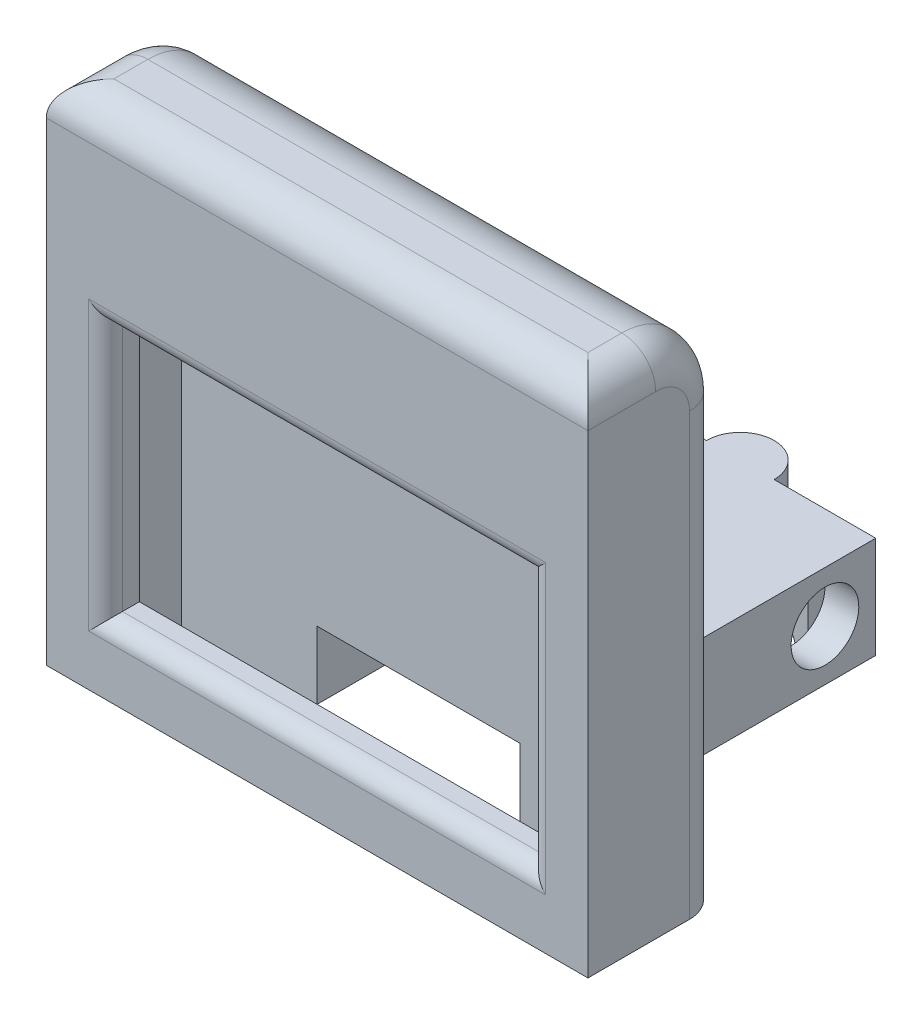
from build123d import *

# Parameters (mm, degrees)
ESQUISSE1_W              = 28
ESQUISSE1_H              = 28
BOSS_EXTRU_1_DEPTH       = 4
COQUE1_T                 = 2
ENL_V_MAT_EXTRU_1_REACH  = 45.174
ESQUISSE2_W              = 25
ESQUISSE2_H              = 15
ESQUISSE8_W              = 16
ESQUISSE8_H              = 6
BOSS_EXTRU_3_DEPTH       = 17
ESQUISSE10_W             = 12
ESQUISSE10_H             = 19.153338928
ENL_V_MAT_EXTRU_3_DEPTH  = 4
ESQUISSE11_R             = 2
ENL_V_MAT_EXTRU_4_DEPTH  = 2
ENL_V_START              = -2
ESQUISSE13_R             = 2
ENL_V_MAT_EXTRU_9_DEPTH  = 2
ESQUISSE15_R             = 2
BOSS_EXTRU_5_DEPTH       = 6
ESQUISSE16_R             = 2
BOSS_EXTRU_6_DEPTH       = 6
ESQUISSE17_R             = 2
BOSS_EXTRU_7_DEPTH       = 6
ESQUISSE18_R             = 1
ENL_V_MAT_EXTRU_10_DEPTH = 5.5
CONG_1_R                 = 4
CONG_2_R                 = 2
CONG_3_R                 = 1
ENL_V_MAT_EXTRU_11_REACH = 51.244
ESQUISSE19_R             = 1.25
ENL_V_MAT_EXTRU_12_DEPTH = 1.5


with BuildPart() as part:
    # Esquisse1 → Boss.-Extru.1 (new body)
    with BuildSketch(Plane.XY):
        with Locations((14, 14)):
            Rectangle(ESQUISSE1_W, ESQUISSE1_H)
    extrude(amount=BOSS_EXTRU_1_DEPTH)

    # Coque1
    coque1_openings = [part.faces().sort_by_distance(p)[0] for p in [
        (14, 0, 2),
    ]]
    offset(amount=COQUE1_T, openings=coque1_openings, kind=Kind.INTERSECTION)

    # Esquisse2 → Enlèv. mat.-Extru.1 (cut, up to next)
    with BuildSketch(Plane.XY.offset(6), mode=Mode.PRIVATE) as enl_v_mat_extru_1_sk1:
        with Locations((14, 11.5)):
            Rectangle(ESQUISSE2_W, ESQUISSE2_H)
    enl_v_mat_extru_1_tool1 = extrude(enl_v_mat_extru_1_sk1.sketch, amount=-ENL_V_MAT_EXTRU_1_REACH, mode=Mode.PRIVATE) & part.part
    add(enl_v_mat_extru_1_tool1.solids().sort_by_distance((14, 11.5, 6))[0], mode=Mode.SUBTRACT)

    # Esquisse8 → Boss.-Extru.3 (add)
    with BuildSketch(Plane(origin=(0, 0, -2), x_dir=(-1, 0, 0), z_dir=(0, 0, -1))):
        with Locations((-14, 3)):
            Rectangle(ESQUISSE8_W, ESQUISSE8_H)
    extrude(amount=BOSS_EXTRU_3_DEPTH)

    # Esquisse10 → Enlèv. mat.-Extru.3 (cut)
    with BuildSketch(Plane.XZ):
        with Locations((14, -7.423330536)):
            Rectangle(ESQUISSE10_W, ESQUISSE10_H)
    extrude(amount=-ENL_V_MAT_EXTRU_3_DEPTH, mode=Mode.SUBTRACT)

    # Esquisse11 → Enlèv. mat.-Extru.4 (cut)
    with BuildSketch(Plane(origin=(22, 0, 0), x_dir=(0, 0, -1), z_dir=(1, 0, 0))):
        with Locations(Location((16, 3, 0), (0, 0, 90))):
            Circle(ESQUISSE11_R)
    extrude(amount=-ENL_V_MAT_EXTRU_4_DEPTH, mode=Mode.SUBTRACT)

    # Esquisse13 → Enlèv. mat.-Extru.9 (cut)
    with BuildSketch(Plane.ZY.offset(-6).offset(ENL_V_START)):
        with Locations(Location((-16, 3, 0), (0, 0, 90))):
            Circle(ESQUISSE13_R)
    extrude(amount=ENL_V_MAT_EXTRU_9_DEPTH, mode=Mode.SUBTRACT)

    # Esquisse15 → Boss.-Extru.5 (add)
    with BuildSketch(Plane.XZ):
        with Locations((6, -2)):
            Circle(ESQUISSE15_R)
    extrude(amount=-BOSS_EXTRU_5_DEPTH)

    # Esquisse16 → Boss.-Extru.6 (add)
    with BuildSketch(Plane.XZ):
        with Locations((22, -2)):
            Circle(ESQUISSE16_R)
    extrude(amount=-BOSS_EXTRU_6_DEPTH)

    # Esquisse17 → Boss.-Extru.7 (add)
    with BuildSketch(Plane.XZ):
        with Locations((14, -19)):
            Circle(ESQUISSE17_R)
    extrude(amount=-BOSS_EXTRU_7_DEPTH)

    # Esquisse18 → Enlèv. mat.-Extru.10 (cut)
    with BuildSketch(Plane.XZ):
        with Locations(Location((6, -2, 0), (0, 0, 270))):
            Circle(ESQUISSE18_R)
        with Locations(Location((14, -19, 0), (0, 0, 270))):
            Circle(ESQUISSE18_R)
        with Locations(Location((22, -2, 0), (0, 0, 270))):
            Circle(ESQUISSE18_R)
    extrude(amount=-ENL_V_MAT_EXTRU_10_DEPTH, mode=Mode.SUBTRACT)

    # Congé1
    cong_1_edges = [part.edges().sort_by_distance(p)[0] for p in [
        (14, 30, -2),
    ]]
    fillet(cong_1_edges, radius=CONG_1_R)

    # Congé2
    cong_2_edges = [part.edges().sort_by_distance(p)[0] for p in [
        (14, 30, 6),
        (-2, 13, -2),
        (-2, 28.828427125, -0.828427125),
        (30, 28.828427125, -0.828427125),
        (30, 13, -2),
        (-2, 30, 4),
        (30, 30, 4),
    ]]
    fillet(cong_2_edges, radius=CONG_2_R)

    # Congé3
    cong_3_edges = [part.edges().sort_by_distance(p)[0] for p in [
        (1.5, 11.5, 6),
        (14, 4, 6),
        (26.5, 11.5, 6),
        (14, 19, 6),
    ]]
    fillet(cong_3_edges, radius=CONG_3_R)

    # Esquisse19 → Enlèv. mat.-Extru.11 (cut, up to next)
    with BuildSketch(Plane(origin=(0, 0, -19), x_dir=(-1, 0, 0), z_dir=(0, 0, -1)), mode=Mode.PRIVATE) as enl_v_mat_extru_11_sk1:
        with Locations((-18, 0)):
            Circle(ESQUISSE19_R)
    enl_v_mat_extru_11_tool1 = extrude(enl_v_mat_extru_11_sk1.sketch, amount=-ENL_V_MAT_EXTRU_11_REACH, mode=Mode.PRIVATE) & part.part
    add(enl_v_mat_extru_11_tool1.solids().sort_by_distance((18, 0, -19))[0], mode=Mode.SUBTRACT)

    # Esquisse20 → Enlèv. mat.-Extru.12 (cut)
    # profile 1 of 11: a face of its own
    with BuildSketch(Plane(origin=(0, 0, -2), x_dir=(-1, 0, 0), z_dir=(0, 0, -1))):
        Polygon((-26.991777923, 22.198020815), (-26.677675359, 22.198020815), (-26.677675359, 20.762123379), (-24.882803564, 20.762123379), (-24.882803564, 22.198020815), (-24.568701, 22.198020815), (-24.568701, 18.698020815), (-24.882803564, 18.698020815), (-24.882803564, 20.40314902), (-26.677675359, 20.40314902), (-26.677675359, 18.698020815), (-26.991777923, 18.698020815), align=None)
    # profile 2 of 11: a face of its own
    with BuildSketch(Plane(origin=(0, 0, -2), x_dir=(-1, 0, 0), z_dir=(0, 0, -1))):
        with BuildLine():
            Line((-23.671265103, 22.198020815), (-23.357162539, 22.198020815))
            Line((-23.357162539, 22.198020815), (-23.357162539, 20.100965527))
            add(Edge.make_bspline(
                [(-23.357162539, 20.100965527), (-23.357209283, 20.071284791), (-23.357297987, 20.01496048), (-23.356705474, 19.93479218), (-23.355046105, 19.863519721), (-23.353999946, 19.800868373), (-23.351672612, 19.747125626), (-23.349774565, 19.702000315), (-23.347334009, 19.665706112), (-23.344400891, 19.644525186), (-23.343140103, 19.635420655)],
                knots=[0, 0, 0, 0, 1.528628734, 2.90083645, 4.128790002, 5.200304208, 6.127813768, 6.898992206, 7.526736466, 8, 8, 8, 8], degree=3))
            add(Edge.make_bspline(
                [(-23.343140103, 19.635420655), (-23.337962644, 19.602573892), (-23.327899458, 19.538731163), (-23.30225308, 19.447822881), (-23.266435579, 19.365891422), (-23.223992536, 19.290380131), (-23.168059925, 19.223390771), (-23.10105639, 19.161679118), (-23.019878621, 19.107707314), (-22.929618015, 19.058356502), (-22.832332778, 19.01869142), (-22.732921512, 18.988698055), (-22.632878532, 18.970419156), (-22.565902367, 18.968302617), (-22.532643308, 18.967251585)],
                knots=[0, 0, 0, 0, 1.035780045, 2.013197591, 2.933192213, 3.817615948, 4.702609284, 5.640816605, 6.646850145, 7.73207398, 8.84249596, 9.914020372, 10.964143139, 12, 12, 12, 12], degree=3))
            add(Edge.make_bspline(
                [(-22.532643308, 18.967251585), (-22.504089568, 18.968325435), (-22.447147006, 18.970466933), (-22.362540575, 18.983728364), (-22.280140466, 19.00762893), (-22.199539786, 19.038468688), (-22.123988802, 19.079216279), (-22.05344536, 19.126287119), (-21.990481426, 19.181497995), (-21.933023428, 19.242598339), (-21.882988492, 19.311538139), (-21.839617351, 19.386816277), (-21.804091421, 19.469565624), (-21.786547896, 19.527720046), (-21.777535135, 19.557596136)],
                knots=[0, 0, 0, 0, 0.994687771, 1.983630487, 2.973142513, 3.978332533, 4.983357753, 5.956394766, 6.925816176, 7.893390482, 8.871859704, 9.88551698, 10.913711441, 12, 12, 12, 12], degree=3))
            add(Edge.make_bspline(
                [(-21.777535135, 19.557596136), (-21.77453501, 19.56994471), (-21.767849521, 19.59746231), (-21.761602476, 19.643983601), (-21.755095951, 19.698872965), (-21.750581381, 19.762524778), (-21.746180161, 19.83472575), (-21.743547088, 19.915852008), (-21.742330055, 20.005608968), (-21.741967375, 20.06824613), (-21.741777923, 20.100965527)],
                knots=[0, 0, 0, 0, 0.558680831, 1.244966039, 2.062412453, 2.990489873, 4.051219941, 5.244515665, 6.560634259, 8, 8, 8, 8], degree=3))
            Line((-21.741777923, 20.100965527), (-21.741777923, 22.198020815))
            Line((-21.741777923, 22.198020815), (-21.427675359, 22.198020815))
            Line((-21.427675359, 22.198020815), (-21.427675359, 20.084138604))
            add(Edge.make_bspline(
                [(-21.427675359, 20.084138604), (-21.42792948, 20.046040225), (-21.428425411, 19.971688922), (-21.432725988, 19.862737563), (-21.439582987, 19.759384582), (-21.449271075, 19.661616085), (-21.462108079, 19.569781926), (-21.476383299, 19.483077158), (-21.494562832, 19.402124165), (-21.515796233, 19.326291747), (-21.540069781, 19.254106234), (-21.57151093, 19.185597619), (-21.60693543, 19.11868322), (-21.648950083, 19.054375111), (-21.696161465, 18.992388558), (-21.749613146, 18.933099483), (-21.807537307, 18.875560436), (-21.870896866, 18.82124737), (-21.938647392, 18.771438693), (-22.010587349, 18.727640922), (-22.086164119, 18.690617305), (-22.165181245, 18.66014138), (-22.247672448, 18.637226781), (-22.333639808, 18.620151625), (-22.423279001, 18.610449328), (-22.484243657, 18.609007398), (-22.515115263, 18.608277226)],
                knots=[0, 0, 0, 0, 1.316592851, 2.569410997, 3.76748051, 4.895814652, 5.963796859, 6.97159953, 7.931736103, 8.829262218, 9.692595152, 10.560224239, 11.431080259, 12.30701507, 13.211635791, 14.121146779, 15.063487852, 16.031507147, 17.00238618, 17.966455255, 18.938106653, 19.907068911, 20.888905087, 21.893141452, 22.933117798, 24, 24, 24, 24], degree=3))
            add(Edge.make_bspline(
                [(-22.515115263, 18.608277226), (-22.548784366, 18.609061991), (-22.614843025, 18.610601697), (-22.712181092, 18.619424448), (-22.805495288, 18.636042842), (-22.895771165, 18.657202786), (-22.981779662, 18.686386523), (-23.064673107, 18.720484648), (-23.143031788, 18.762361908), (-23.218126916, 18.808955301), (-23.287951673, 18.861379939), (-23.352049076, 18.918520113), (-23.410524946, 18.979460491), (-23.462393643, 19.044860856), (-23.508514527, 19.114212563), (-23.548244741, 19.187711803), (-23.582357985, 19.265330119), (-23.599964552, 19.31928332), (-23.608865263, 19.346558476)],
                knots=[0, 0, 0, 0, 1.13879206, 2.234305948, 3.301075583, 4.341971843, 5.366689343, 6.369221514, 7.369726634, 8.367512178, 9.355451585, 10.318319045, 11.268648973, 12.207971039, 13.137398894, 14.081662264, 15.030215811, 16, 16, 16, 16], degree=3))
            add(Edge.make_bspline(
                [(-23.608865263, 19.346558476), (-23.614042421, 19.36519105), (-23.625271793, 19.405605519), (-23.63729709, 19.472492007), (-23.647406172, 19.549506925), (-23.65691173, 19.636655544), (-23.662520688, 19.73400541), (-23.667438127, 19.841514326), (-23.671299746, 19.959312288), (-23.671276973, 20.041366803), (-23.671265103, 20.084138604)],
                knots=[0, 0, 0, 0, 0.625038921, 1.35572334, 2.194682327, 3.136881307, 4.189498639, 5.346923369, 6.617055217, 8, 8, 8, 8], degree=3))
            Line((-23.671265103, 20.084138604), (-23.671265103, 22.198020815))
        make_face()
    # profile 3 of 11: a face of its own
    with BuildSketch(Plane(origin=(0, 0, -2), x_dir=(-1, 0, 0), z_dir=(0, 0, -1))):
        Polygon((-20.709726641, 18.698020815), (-20.247687379, 22.198020815), (-20.202815584, 22.198020815), (-18.757803564, 19.326225943), (-17.316297154, 22.198020815), (-17.270724237, 22.198020815), (-16.805880487, 18.698020815), (-17.121385295, 18.698020815), (-17.456521513, 21.216450302), (-18.719942987, 18.698020815), (-18.790756289, 18.698020815), (-20.059085616, 21.222059277), (-20.393520712, 18.698020815), align=None)
    # profile 4 of 11: a face of its own
    with BuildSketch(Plane(origin=(0, 0, -2), x_dir=(-1, 0, 0), z_dir=(0, 0, -1))):
        Polygon((-14.652034334, 22.198020815), (-13.036649718, 18.698020815), (-13.378096032, 18.698020815), (-13.895523917, 19.819815687), (-15.482162539, 19.819815687), (-16.014313981, 18.698020815), (-16.357162539, 18.698020815), (-14.696906129, 22.198020815), align=None)
        Polygon((-14.67797584, 21.515829309), (-15.311789943, 20.178790046), (-14.060988661, 20.178790046), align=None, mode=Mode.SUBTRACT)
    # profile 5 of 11: a face of its own
    with BuildSketch(Plane(origin=(0, 0, -2), x_dir=(-1, 0, 0), z_dir=(0, 0, -1))):
        Polygon((-12.40844459, 18.698020815), (-12.40844459, 22.198020815), (-12.342539141, 22.198020815), (-10.030239462, 19.443313283), (-10.030239462, 22.198020815), (-9.716136898, 22.198020815), (-9.716136898, 18.698020815), (-9.787651321, 18.698020815), (-12.094342026, 21.446418251), (-12.094342026, 18.698020815), align=None)
    # profile 6 of 11: a face of its own
    with BuildSketch(Plane(origin=(0, 0, -2), x_dir=(-1, 0, 0), z_dir=(0, 0, -1))):
        Polygon((-8.818701, 22.198020815), (-8.504598436, 22.198020815), (-8.504598436, 19.056995174), (-7.15844459, 19.056995174), (-7.15844459, 18.698020815), (-8.818701, 18.698020815), align=None)
    # profile 7 of 11: a face of its own
    with BuildSketch(Plane(origin=(0, 0, -2), x_dir=(-1, 0, 0), z_dir=(0, 0, -1))):
        Polygon((-5.139213821, 22.198020815), (-3.523829205, 18.698020815), (-3.86527552, 18.698020815), (-4.382703404, 19.819815687), (-5.969342026, 19.819815687), (-6.501493468, 18.698020815), (-6.844342026, 18.698020815), (-5.184085616, 22.198020815), align=None)
        Polygon((-5.165155327, 21.515829309), (-5.79896943, 20.178790046), (-4.548168148, 20.178790046), align=None, mode=Mode.SUBTRACT)
    # profile 8 of 11: a face of its own
    with BuildSketch(Plane(origin=(0, 0, -2), x_dir=(-1, 0, 0), z_dir=(0, 0, -1))):
        with BuildLine():
            Line((-2.895624077, 22.198020815), (-2.212731449, 22.198020815))
            add(Edge.make_bspline(
                [(-2.212731449, 22.198020815), (-2.179302971, 22.197845065), (-2.114510261, 22.197504417), (-2.020290819, 22.192221286), (-1.932042008, 22.185017616), (-1.849738236, 22.173587523), (-1.773417533, 22.159795746), (-1.702849896, 22.14309393), (-1.638259724, 22.123067316), (-1.561146987, 22.091221035), (-1.473226327, 22.043897867), (-1.378027934, 21.973969302), (-1.296623694, 21.888436838), (-1.226437377, 21.791954183), (-1.170636258, 21.685818411), (-1.13026696, 21.572559223), (-1.104709085, 21.453637481), (-1.102080651, 21.371994303), (-1.100752282, 21.330733155)],
                knots=[0, 0, 0, 0, 1.001505555, 1.941167018, 2.826882275, 3.653841531, 4.429895133, 5.150066043, 5.825578002, 6.45369114, 7.647487171, 8.808567382, 9.977351308, 11.170798116, 12.373658725, 13.556498008, 14.765093433, 16, 16, 16, 16], degree=3))
            add(Edge.make_bspline(
                [(-1.100752282, 21.330733155), (-1.101845501, 21.292080599), (-1.103993778, 21.216124682), (-1.124536537, 21.105030573), (-1.156697206, 20.999279354), (-1.201402455, 20.899256969), (-1.259504451, 20.807223356), (-1.32836277, 20.72243609), (-1.411439572, 20.648485033), (-1.473682812, 20.60714213), (-1.505299558, 20.586141809)],
                knots=[0, 0, 0, 0, 1.044552857, 2.05264487, 3.044412934, 4.028983338, 5.005914585, 5.980388656, 6.974128949, 8, 8, 8, 8], degree=3))
            add(Edge.make_bspline(
                [(-1.505299558, 20.586141809), (-1.46553913, 20.57087681), (-1.389467583, 20.541671086), (-1.284781571, 20.490035622), (-1.194586726, 20.433873511), (-1.11818958, 20.372541661), (-1.052851925, 20.30643285), (-0.995798983, 20.234577736), (-0.947117609, 20.156038978), (-0.905404685, 20.071635443), (-0.872855929, 19.982228974), (-0.848480025, 19.888658198), (-0.834512576, 19.791258643), (-0.832524935, 19.724973264), (-0.831521513, 19.691510399)],
                knots=[0, 0, 0, 0, 1.27268992, 2.434971085, 3.483601985, 4.442670788, 5.356604649, 6.2567628, 7.179492994, 8.113709626, 9.066344395, 10.018646069, 10.999752585, 12, 12, 12, 12], degree=3))
            add(Edge.make_bspline(
                [(-0.831521513, 19.691510399), (-0.832498359, 19.657343527), (-0.834420331, 19.590119248), (-0.848600303, 19.491364114), (-0.87260941, 19.396989167), (-0.905680556, 19.306383985), (-0.948842871, 19.21972385), (-1.001370835, 19.136910586), (-1.064002399, 19.058776255), (-1.134065268, 18.984452632), (-1.213327413, 18.917624845), (-1.298843168, 18.858109138), (-1.391689488, 18.809163076), (-1.490341482, 18.768047055), (-1.595905798, 18.736639856), (-1.707908406, 18.714667282), (-1.826252707, 18.699862245), (-1.907462458, 18.69864504), (-1.949109654, 18.698020815)],
                knots=[0, 0, 0, 0, 0.978564426, 1.925352924, 2.850884081, 3.763762016, 4.682927383, 5.618979971, 6.567305752, 7.547517671, 8.540179244, 9.531824382, 10.526200242, 11.540722885, 12.589160233, 13.674978461, 14.80764778, 16, 16, 16, 16], degree=3))
            Line((-1.949109654, 18.698020815), (-2.895624077, 18.698020815))
            Line((-2.895624077, 18.698020815), (-2.895624077, 22.198020815))
        make_face()
        with BuildLine():
            Line((-2.581521513, 21.839046456), (-2.581521513, 20.717251585))
            Line((-2.581521513, 20.717251585), (-2.370483853, 20.717251585))
            add(Edge.make_bspline(
                [(-2.370483853, 20.717251585), (-2.339635058, 20.717651508), (-2.280028898, 20.71842424), (-2.193709002, 20.720637757), (-2.113583984, 20.726835801), (-2.03979215, 20.733032063), (-1.972449706, 20.74310665), (-1.911705845, 20.755098773), (-1.856607248, 20.767781678), (-1.793067702, 20.789351165), (-1.720994754, 20.821228841), (-1.64416165, 20.870700677), (-1.57642718, 20.92962503), (-1.519229993, 20.997615992), (-1.472418522, 21.072482177), (-1.439904807, 21.153029058), (-1.417857523, 21.23724919), (-1.415865991, 21.295067443), (-1.414854846, 21.324423059)],
                knots=[0, 0, 0, 0, 1.156816544, 2.235205308, 3.236616184, 4.169592532, 5.011045266, 5.787822928, 6.49130361, 7.128639758, 8.301311294, 9.436451833, 10.541879658, 11.654887649, 12.756523258, 13.837046038, 14.901820046, 16, 16, 16, 16], degree=3))
            add(Edge.make_bspline(
                [(-1.414854846, 21.324423059), (-1.415381027, 21.34384883), (-1.416413187, 21.381954602), (-1.424866489, 21.437503957), (-1.439234064, 21.489747709), (-1.457688357, 21.539401819), (-1.483477046, 21.58491367), (-1.513840509, 21.627856865), (-1.550526199, 21.666768984), (-1.592283512, 21.703138482), (-1.640292135, 21.73538301), (-1.694523426, 21.763623773), (-1.755711104, 21.78636455), (-1.822823959, 21.806280702), (-1.896895046, 21.820268996), (-1.977069599, 21.831922384), (-2.064004318, 21.837855126), (-2.124149421, 21.838640489), (-2.155239462, 21.839046456)],
                knots=[0, 0, 0, 0, 0.91205012, 1.789085906, 2.630437955, 3.453916878, 4.269457761, 5.079663411, 5.91843418, 6.774407191, 7.675494373, 8.627863946, 9.638891023, 10.736472738, 11.911756761, 13.175263542, 14.539845004, 16, 16, 16, 16], degree=3))
            Line((-2.155239462, 21.839046456), (-2.581521513, 21.839046456))
        make_face(mode=Mode.SUBTRACT)
        with BuildLine():
            Line((-2.581521513, 20.358277226), (-2.581521513, 19.056995174))
            Line((-2.581521513, 19.056995174), (-2.134205808, 19.056995174))
            add(Edge.make_bspline(
                [(-2.134205808, 19.056995174), (-2.102186882, 19.057378922), (-2.040474624, 19.058118544), (-1.951373393, 19.060533099), (-1.86879029, 19.066025374), (-1.793102154, 19.074671224), (-1.723491701, 19.084049673), (-1.660793998, 19.096660954), (-1.604500805, 19.111109915), (-1.539226497, 19.133444087), (-1.465722989, 19.168140558), (-1.386512132, 19.220454784), (-1.316085914, 19.282778092), (-1.256280655, 19.354909006), (-1.207267666, 19.433340333), (-1.171612211, 19.516485683), (-1.149621355, 19.602971211), (-1.146959185, 19.661937923), (-1.145624077, 19.691510399)],
                knots=[0, 0, 0, 0, 1.160039823, 2.235823828, 3.228722157, 4.157150951, 4.99529583, 5.772374946, 6.472645482, 7.099169577, 8.269452708, 9.405989375, 10.527446681, 11.663510218, 12.788923519, 13.866172445, 14.929861265, 16, 16, 16, 16], degree=3))
            add(Edge.make_bspline(
                [(-1.145624077, 19.691510399), (-1.145900182, 19.710003739), (-1.146447937, 19.746692121), (-1.154708552, 19.80060794), (-1.166722421, 19.852833813), (-1.182253855, 19.903511554), (-1.204873322, 19.95172493), (-1.231279867, 19.99842749), (-1.262241269, 20.043680969), (-1.310485435, 20.100893223), (-1.380657419, 20.166810236), (-1.480364195, 20.231347738), (-1.593736493, 20.283395545), (-1.675963986, 20.305495021), (-1.718440584, 20.31691104)],
                knots=[0, 0, 0, 0, 0.723448775, 1.435228256, 2.130040452, 2.821711965, 3.505591119, 4.210454504, 4.921174351, 5.648778258, 7.137944449, 8.670945889, 10.280296675, 12, 12, 12, 12], degree=3))
            add(Edge.make_bspline(
                [(-1.718440584, 20.31691104), (-1.735469679, 20.320366124), (-1.772392272, 20.327857458), (-1.832599852, 20.335765162), (-1.901335721, 20.342810222), (-1.978758598, 20.348021379), (-2.06496644, 20.353407923), (-2.160143358, 20.355502744), (-2.263900673, 20.358002004), (-2.335893045, 20.358183138), (-2.37328834, 20.358277226)],
                knots=[0, 0, 0, 0, 0.634451884, 1.375622551, 2.216452059, 3.157844607, 4.20941857, 5.370758133, 6.634282058, 8, 8, 8, 8], degree=3))
            Line((-2.37328834, 20.358277226), (-2.581521513, 20.358277226))
        make_face(mode=Mode.SUBTRACT)
    # profile 9 of 11: a face of its own
    with BuildSketch(Plane(origin=(0, 0, -2), x_dir=(-1, 0, 0), z_dir=(0, 0, -1))):
        with BuildLine():
            Line((-18.291132891, 15.128746726), (-17.604734654, 15.128746726))
            add(Edge.make_bspline(
                [(-17.604734654, 15.128746726), (-17.557523747, 15.12869483), (-17.467065555, 15.128595395), (-17.337350499, 15.125580649), (-17.219540767, 15.121553957), (-17.113890386, 15.115972063), (-17.020074288, 15.109375473), (-16.938516989, 15.100123434), (-16.868577432, 15.090463138), (-16.826670983, 15.080641732), (-16.807559173, 15.076162592)],
                knots=[0, 0, 0, 0, 1.415646017, 2.712440637, 3.8905458, 4.950247383, 5.884950622, 6.709939814, 7.411656543, 8, 8, 8, 8], degree=3))
            add(Edge.make_bspline(
                [(-16.807559173, 15.076162592), (-16.783365639, 15.069540642), (-16.735548662, 15.05645278), (-16.666647619, 15.030239057), (-16.601093773, 14.999156891), (-16.538662215, 14.963732952), (-16.480120132, 14.922447387), (-16.424594091, 14.87697377), (-16.37257411, 14.826262201), (-16.324352719, 14.770881461), (-16.280067921, 14.711761251), (-16.241938238, 14.648019022), (-16.210011011, 14.580727718), (-16.18262774, 14.509934147), (-16.162919285, 14.435043823), (-16.148072386, 14.356577111), (-16.138648758, 14.274542421), (-16.137746196, 14.218482553), (-16.137286737, 14.189944643)],
                knots=[0, 0, 0, 0, 0.999701418, 1.975846123, 2.934577507, 3.890451536, 4.834027766, 5.787354733, 6.749476667, 7.726910423, 8.712836071, 9.690891519, 10.682875813, 11.679750201, 12.712814741, 13.765529915, 14.8625177, 16, 16, 16, 16], degree=3))
            add(Edge.make_bspline(
                [(-16.137286737, 14.189944643), (-16.137708162, 14.161166866), (-16.138532708, 14.104861202), (-16.148428993, 14.022488414), (-16.161759185, 13.943770024), (-16.182256237, 13.868880573), (-16.20910191, 13.798264803), (-16.240593963, 13.730843571), (-16.278577493, 13.667763899), (-16.322222323, 13.608796782), (-16.370773917, 13.553886869), (-16.424026855, 13.503432075), (-16.481766148, 13.457727736), (-16.543808296, 13.416671393), (-16.610758145, 13.381215113), (-16.681600298, 13.349457808), (-16.756950515, 13.322786748), (-16.809093029, 13.308756686), (-16.835604045, 13.301623329)],
                knots=[0, 0, 0, 0, 1.121902311, 2.195077645, 3.232258892, 4.234102512, 5.217864754, 6.176164875, 7.132989551, 8.084763148, 9.034132444, 9.988522005, 10.94243251, 11.903244335, 12.886203696, 13.894208494, 14.929344452, 16, 16, 16, 16], degree=3))
            add(Edge.make_bspline(
                [(-16.835604045, 13.301623329), (-16.857531379, 13.296960348), (-16.905586406, 13.286741154), (-16.984729128, 13.275332697), (-17.076874514, 13.265595096), (-17.181896794, 13.258293959), (-17.299701699, 13.25204359), (-17.430352956, 13.247075496), (-17.574107033, 13.244345642), (-17.674378277, 13.24420485), (-17.726729846, 13.244131342)],
                knots=[0, 0, 0, 0, 0.601384939, 1.31797006, 2.144135048, 3.087295005, 4.142315834, 5.309527816, 6.595305764, 8, 8, 8, 8], degree=3))
            Line((-17.726729846, 13.244131342), (-17.977030327, 13.244131342))
            Line((-17.977030327, 13.244131342), (-17.977030327, 11.628746726))
            Line((-17.977030327, 11.628746726), (-18.291132891, 11.628746726))
            Line((-18.291132891, 11.628746726), (-18.291132891, 15.128746726))
        make_face()
        with BuildLine():
            Line((-17.977030327, 14.769772367), (-17.977030327, 13.603105701))
            Line((-17.977030327, 13.603105701), (-17.364249878, 13.595393361))
            add(Edge.make_bspline(
                [(-17.364249878, 13.595393361), (-17.334329952, 13.595377897), (-17.276570152, 13.595348045), (-17.193133929, 13.599333269), (-17.115724642, 13.603933801), (-17.044580066, 13.610669725), (-16.979668132, 13.620190982), (-16.920880603, 13.62980272), (-16.86867332, 13.643708083), (-16.807574118, 13.662431152), (-16.739490771, 13.694363768), (-16.665423222, 13.740713658), (-16.602652636, 13.799794366), (-16.548334339, 13.866222197), (-16.505228461, 13.940121327), (-16.473672469, 14.019190263), (-16.455131312, 14.102618113), (-16.452645118, 14.159706252), (-16.451389301, 14.188542399)],
                knots=[0, 0, 0, 0, 1.160613943, 2.240541288, 3.23993089, 4.169200891, 5.011653406, 5.7853311, 6.478053781, 7.106038997, 8.262395093, 9.384106736, 10.481365981, 11.59014053, 12.70357646, 13.786202915, 14.881775077, 16, 16, 16, 16], degree=3))
            add(Edge.make_bspline(
                [(-16.451389301, 14.188542399), (-16.452651948, 14.216680913), (-16.455161932, 14.272616795), (-16.473817796, 14.354595556), (-16.50516711, 14.43283126), (-16.548623704, 14.505804345), (-16.601364834, 14.571993149), (-16.662664177, 14.629490276), (-16.732377438, 14.675711979), (-16.797225669, 14.705545261), (-16.854826855, 14.723760536), (-16.904858815, 14.736505377), (-16.96134949, 14.746680983), (-17.024317269, 14.754920486), (-17.093274103, 14.761973947), (-17.168812418, 14.766759924), (-17.250646061, 14.76956138), (-17.307456632, 14.769700336), (-17.336906128, 14.769772367)],
                knots=[0, 0, 0, 0, 1.120700087, 2.227813068, 3.331159281, 4.466773991, 5.599788987, 6.693661531, 7.80175334, 8.91857717, 9.525282508, 10.207424825, 10.974604443, 11.810962634, 12.737642355, 13.736264703, 14.826523623, 16, 16, 16, 16], degree=3))
            Line((-17.336906128, 14.769772367), (-17.977030327, 14.769772367))
        make_face(mode=Mode.SUBTRACT)
    # profile 10 of 11: a face of its own
    with BuildSketch(Plane(origin=(0, 0, -2), x_dir=(-1, 0, 0), z_dir=(0, 0, -1))):
        with BuildLine():
            Line((-15.419338019, 15.128746726), (-15.105235455, 15.128746726))
            Line((-15.105235455, 15.128746726), (-15.105235455, 13.031691438))
            add(Edge.make_bspline(
                [(-15.105235455, 13.031691438), (-15.105282199, 13.002010702), (-15.105370904, 12.945686391), (-15.10477839, 12.865518091), (-15.103119021, 12.794245632), (-15.102072862, 12.731594284), (-15.099745528, 12.677851537), (-15.097847481, 12.632726226), (-15.095406925, 12.596432023), (-15.092473807, 12.575251097), (-15.091213019, 12.566146566)],
                knots=[0, 0, 0, 0, 1.528628734, 2.90083645, 4.128790002, 5.200304208, 6.127813768, 6.898992206, 7.526736466, 8, 8, 8, 8], degree=3))
            add(Edge.make_bspline(
                [(-15.091213019, 12.566146566), (-15.08603556, 12.533299803), (-15.075972374, 12.469457074), (-15.050325996, 12.378548792), (-15.014508495, 12.296617333), (-14.972065452, 12.221106042), (-14.916132841, 12.154116682), (-14.849129306, 12.092405029), (-14.767951537, 12.038433225), (-14.677690931, 11.989082413), (-14.580405694, 11.949417331), (-14.480994428, 11.919423966), (-14.380951448, 11.901145067), (-14.313975283, 11.899028528), (-14.280716224, 11.897977496)],
                knots=[0, 0, 0, 0, 1.035780045, 2.013197591, 2.933192213, 3.817615948, 4.702609284, 5.640816605, 6.646850145, 7.73207398, 8.84249596, 9.914020372, 10.964143139, 12, 12, 12, 12], degree=3))
            add(Edge.make_bspline(
                [(-14.280716224, 11.897977496), (-14.252162484, 11.899051346), (-14.195219922, 11.901192844), (-14.110613491, 11.914454275), (-14.028213382, 11.938354841), (-13.947612703, 11.969194599), (-13.872061718, 12.00994219), (-13.801518276, 12.05701303), (-13.738554342, 12.112223906), (-13.681096344, 12.17332425), (-13.631061408, 12.24226405), (-13.587690267, 12.317542188), (-13.552164337, 12.400291535), (-13.534620812, 12.458445957), (-13.525608051, 12.488322047)],
                knots=[0, 0, 0, 0, 0.994687771, 1.983630487, 2.973142513, 3.978332533, 4.983357753, 5.956394766, 6.925816176, 7.893390482, 8.871859704, 9.88551698, 10.913711441, 12, 12, 12, 12], degree=3))
            add(Edge.make_bspline(
                [(-13.525608051, 12.488322047), (-13.522607926, 12.500670621), (-13.515922438, 12.528188221), (-13.509675393, 12.574709512), (-13.503168867, 12.629598876), (-13.498654297, 12.693250689), (-13.494253077, 12.765451661), (-13.491620004, 12.846577919), (-13.490402971, 12.936334879), (-13.490040291, 12.998972041), (-13.489850839, 13.031691438)],
                knots=[0, 0, 0, 0, 0.558680831, 1.244966039, 2.062412453, 2.990489873, 4.051219941, 5.244515665, 6.560634259, 8, 8, 8, 8], degree=3))
            Line((-13.489850839, 13.031691438), (-13.489850839, 15.128746726))
            Line((-13.489850839, 15.128746726), (-13.175748275, 15.128746726))
            Line((-13.175748275, 15.128746726), (-13.175748275, 13.014864515))
            add(Edge.make_bspline(
                [(-13.175748275, 13.014864515), (-13.176002396, 12.976766136), (-13.176498327, 12.902414833), (-13.180798904, 12.793463474), (-13.187655903, 12.690110493), (-13.197343991, 12.592341996), (-13.210180995, 12.500507837), (-13.224456215, 12.413803069), (-13.242635748, 12.332850076), (-13.263869149, 12.257017658), (-13.288142697, 12.184832145), (-13.319583846, 12.11632353), (-13.355008346, 12.049409131), (-13.397022999, 11.985101022), (-13.444234381, 11.923114469), (-13.497686062, 11.863825394), (-13.555610223, 11.806286347), (-13.618969782, 11.751973281), (-13.686720308, 11.702164604), (-13.758660265, 11.658366833), (-13.834237035, 11.621343216), (-13.913254161, 11.590867291), (-13.995745364, 11.567952692), (-14.081712724, 11.550877536), (-14.171351917, 11.541175239), (-14.232316573, 11.539733309), (-14.263188179, 11.539003137)],
                knots=[0, 0, 0, 0, 1.316592851, 2.569410997, 3.76748051, 4.895814652, 5.963796859, 6.97159953, 7.931736103, 8.829262218, 9.692595152, 10.560224239, 11.431080259, 12.30701507, 13.211635791, 14.121146779, 15.063487852, 16.031507147, 17.00238618, 17.966455255, 18.938106653, 19.907068911, 20.888905087, 21.893141452, 22.933117798, 24, 24, 24, 24], degree=3))
            add(Edge.make_bspline(
                [(-14.263188179, 11.539003137), (-14.296857282, 11.539787902), (-14.362915941, 11.541327608), (-14.460254008, 11.550150359), (-14.553568204, 11.566768753), (-14.643844081, 11.587928697), (-14.729852578, 11.617112434), (-14.812746023, 11.651210559), (-14.891104704, 11.693087819), (-14.966199833, 11.739681212), (-15.036024589, 11.79210585), (-15.100121992, 11.849246024), (-15.158597862, 11.910186402), (-15.210466559, 11.975586767), (-15.256587443, 12.044938474), (-15.296317657, 12.118437714), (-15.330430901, 12.19605603), (-15.348037468, 12.250009231), (-15.356938179, 12.277284387)],
                knots=[0, 0, 0, 0, 1.13879206, 2.234305948, 3.301075583, 4.341971843, 5.366689343, 6.369221514, 7.369726634, 8.367512178, 9.355451585, 10.318319045, 11.268648973, 12.207971039, 13.137398894, 14.081662264, 15.030215811, 16, 16, 16, 16], degree=3))
            add(Edge.make_bspline(
                [(-15.356938179, 12.277284387), (-15.362115337, 12.295916961), (-15.373344709, 12.33633143), (-15.385370006, 12.403217918), (-15.395479088, 12.480232836), (-15.404984646, 12.567381455), (-15.410593604, 12.664731321), (-15.415511043, 12.772240237), (-15.419372662, 12.890038199), (-15.419349889, 12.972092714), (-15.419338019, 13.014864515)],
                knots=[0, 0, 0, 0, 0.625038921, 1.35572334, 2.194682327, 3.136881307, 4.189498639, 5.346923369, 6.617055217, 8, 8, 8, 8], degree=3))
            Line((-15.419338019, 13.014864515), (-15.419338019, 15.128746726))
        make_face()
    # profile 11 of 11: a face of its own
    with BuildSketch(Plane(origin=(0, 0, -2), x_dir=(-1, 0, 0), z_dir=(0, 0, -1))):
        Polygon((-11.848524718, 15.128746726), (-11.201389301, 15.128746726), (-11.201389301, 11.628746726), (-11.515491865, 11.628746726), (-11.515491865, 14.769772367), (-12.053953404, 14.769772367), align=None)
    extrude(amount=-ENL_V_MAT_EXTRU_12_DEPTH, mode=Mode.SUBTRACT)


solid = part.part
